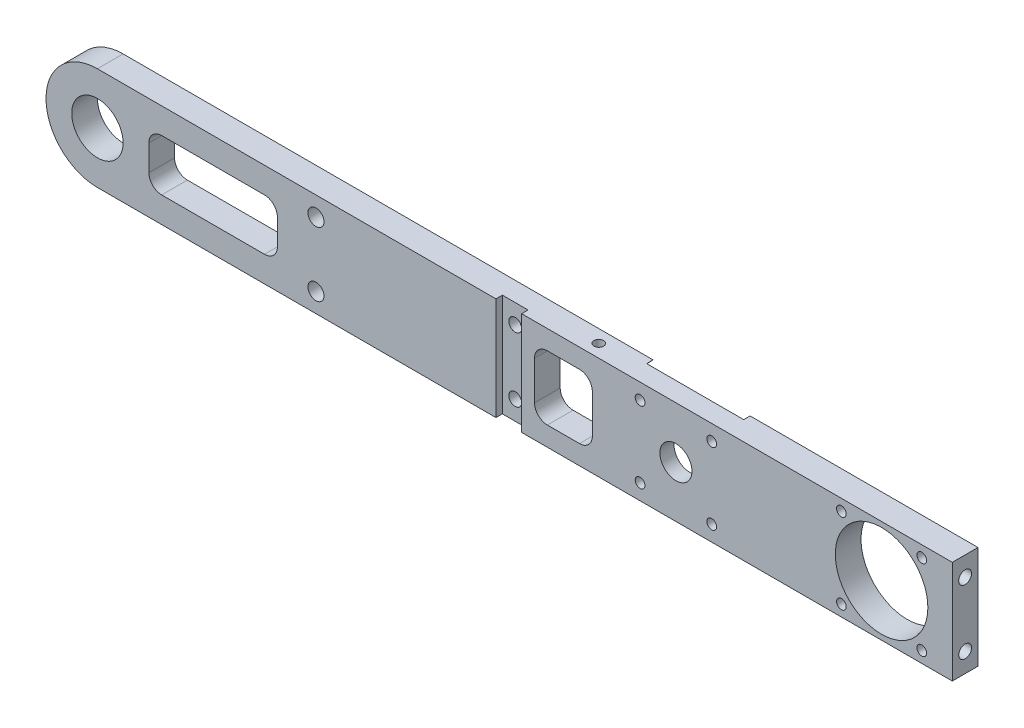
from build123d import *
from build123d.topology import SkipClean

# Parameters (mm, degrees)
SKETCH1_R           = 12.7
SKETCH1_R_2         = 7.9375
SKETCH1_R_3         = 22.86
EXTRUDE1_DEPTH      = 12.7
SKETCH2_W           = 12.7
SKETCH2_H           = 50.8
CUT_EXTRUDE1_DEPTH  = 3.175
SKETCH4_R           = 34.925
CUT_EXTRUDE3_DEPTH  = 3.175
SKETCH5_R           = 17.4625
CUT_EXTRUDE4_DEPTH  = 2.54
CUT_EXTRUDE5_DEPTH  = 451.727007872
SKETCH7_R           = 12.7
CUT_EXTRUDE6_DEPTH  = 9.525
SKETCH8_R           = 2.413
CUT_EXTRUDE7_DEPTH  = 451.648722677
CIRPATTERN1_COUNT   = 4
SKETCH9_R           = 2.38125
CUT_EXTRUDE8_DEPTH  = 451.727007872
SKETCH10_R          = 3.96875
CUT_EXTRUDE9_DEPTH  = 451.727007872
SKETCH11_W          = 41.275
SKETCH11_H          = 31.75
EXTRUDE2_DEPTH      = 3.175
CUT_EXTRUDE10_REACH = 452.727
SKETCH12_R          = 3.175
SKETCH13_R          = 3.175
CUT_EXTRUDE11_DEPTH = 451.648722679
SKETCH15_R          = 2.38125
CUT_EXTRUDE13_DEPTH = 15.875
CUT_EXTRUDE14_START = -15.875
SKETCH16_R          = 2.38125
CUT_EXTRUDE14_DEPTH = 15.875


with BuildPart() as part:
    # Sketch1 → Extrude1 (new body)
    with BuildSketch(Plane.XY):
        with BuildLine():
            Line((0, 50.8), (-422.275, 50.8))
            ThreePointArc((-422.275, 50.8), (-447.675, 25.4), (-422.275, 0))
            Line((-422.275, 0), (0, 0))
            Line((0, 0), (0, 50.8))
        make_face()
        with Locations((-422.275, 25.4)):
            Circle(SKETCH1_R, mode=Mode.SUBTRACT)
        with Locations((-136.525, 25.4)):
            Circle(SKETCH1_R_2, mode=Mode.SUBTRACT)
        with Locations((-34.925, 25.4)):
            Circle(SKETCH1_R_3, mode=Mode.SUBTRACT)
    extrude(amount=EXTRUDE1_DEPTH)

    # Sketch2 → Cut-Extrude1 (cut)
    with BuildSketch(Plane.XY.offset(12.7)):
        with Locations((-219.075, 25.4)):
            Rectangle(SKETCH2_W, SKETCH2_H)
    extrude(amount=-CUT_EXTRUDE1_DEPTH, mode=Mode.SUBTRACT)

    # Sketch4 → Cut-Extrude3 (cut)
    with BuildSketch(Plane(origin=(0, 0, 0), x_dir=(-1, 0, 0), z_dir=(0, 0, -1))):
        with Locations((136.525, 25.4)):
            Circle(SKETCH4_R)
    extrude(amount=-CUT_EXTRUDE3_DEPTH, mode=Mode.SUBTRACT)

    # Sketch5 → Cut-Extrude4 (cut)
    with BuildSketch(Plane(origin=(0, 0, 3.175), x_dir=(-1, 0, 0), z_dir=(0, 0, -1))):
        with Locations((136.525, 25.4)):
            Circle(SKETCH5_R)
    extrude(amount=-CUT_EXTRUDE4_DEPTH, mode=Mode.SUBTRACT)

    # Sketch6 → Cut-Extrude5 (cut, through all)
    with BuildSketch(Plane.XY.offset(12.7)):
        with BuildLine():
            Line((-390.525, 38.1), (-339.725, 38.1))
            ThreePointArc((-339.725, 38.1), (-335.234871939, 36.240128061), (-333.375, 31.75))
            Line((-333.375, 31.75), (-333.375, 19.05))
            ThreePointArc((-333.375, 19.05), (-335.234871939, 14.559871939), (-339.725, 12.7))
            Line((-339.725, 12.7), (-390.525, 12.7))
            ThreePointArc((-390.525, 12.7), (-395.015128061, 14.559871939), (-396.875, 19.05))
            Line((-396.875, 19.05), (-396.875, 31.75))
            ThreePointArc((-396.875, 31.75), (-395.015128061, 36.240128061), (-390.525, 38.1))
        make_face()
        with BuildLine():
            Line((-266.7, 41.275), (-238.125, 41.275))
            ThreePointArc((-238.125, 41.275), (-233.634871939, 39.415128061), (-231.775, 34.925))
            Line((-231.775, 34.925), (-231.775, 15.875))
            ThreePointArc((-231.775, 15.875), (-233.634871939, 11.384871939), (-238.125, 9.525))
            Line((-238.125, 9.525), (-266.7, 9.525))
            ThreePointArc((-266.7, 9.525), (-271.190128061, 11.384871939), (-273.05, 15.875))
            Line((-273.05, 15.875), (-273.05, 34.925))
            ThreePointArc((-273.05, 34.925), (-271.190128061, 39.415128061), (-266.7, 41.275))
        make_face()
        with BuildLine():
            Line((-200.025, 41.275), (-184.15, 41.275))
            ThreePointArc((-184.15, 41.275), (-179.659871939, 39.415128061), (-177.8, 34.925))
            Line((-177.8, 34.925), (-177.8, 15.875))
            ThreePointArc((-177.8, 15.875), (-179.659871939, 11.384871939), (-184.15, 9.525))
            Line((-184.15, 9.525), (-200.025, 9.525))
            ThreePointArc((-200.025, 9.525), (-204.515128061, 11.384871939), (-206.375, 15.875))
            Line((-206.375, 15.875), (-206.375, 34.925))
            ThreePointArc((-206.375, 34.925), (-204.515128061, 39.415128061), (-200.025, 41.275))
        make_face()
    extrude(amount=-CUT_EXTRUDE5_DEPTH, mode=Mode.SUBTRACT)

    # Sketch7 → Cut-Extrude6 (cut)
    with BuildSketch(Plane(origin=(0, 0, 0), x_dir=(-1, 0, 0), z_dir=(0, 0, -1))):
        with Locations((80.9625, 31.75)):
            Circle(SKETCH7_R)
    extrude(amount=-CUT_EXTRUDE6_DEPTH, mode=Mode.SUBTRACT)

    # Sketch8 → Cut-Extrude7 (cut, through all)
    with BuildSketch(Plane(origin=(0, 0, 3.175), x_dir=(-1, 0, 0), z_dir=(0, 0, -1))):
        with Locations((118.833895441, 43.091104559)):
            Circle(SKETCH8_R)
    cut_extrude7 = extrude(amount=-CUT_EXTRUDE7_DEPTH, mode=Mode.SUBTRACT)

    # CirPattern1: Cut-Extrude7 ×4 about axis
    cirpattern1_axis = Axis((-136.525, 25.4, 0), (0, 0, 1))
    for i in range(1, CIRPATTERN1_COUNT):
        add(cut_extrude7.rotate(cirpattern1_axis, i * 360 / CIRPATTERN1_COUNT), mode=Mode.SUBTRACT)

    # Sketch9 → Cut-Extrude8 (cut, through all)
    with BuildSketch(Plane(origin=(0, 0, 0), x_dir=(-1, 0, 0), z_dir=(0, 0, -1))):
        with Locations((15.08125, 45.24375)):
            Circle(SKETCH9_R)
        with Locations((54.76875, 45.24375)):
            Circle(SKETCH9_R)
        with Locations((54.76875, 5.55625)):
            Circle(SKETCH9_R)
        with Locations((15.08125, 5.55625)):
            Circle(SKETCH9_R)
    extrude(amount=-CUT_EXTRUDE8_DEPTH, mode=Mode.SUBTRACT)

    # Sketch10 → Cut-Extrude9 (cut, through all)
    with BuildSketch(Plane(origin=(0, 0, 0), x_dir=(-1, 0, 0), z_dir=(0, 0, -1))):
        with Locations((314.325, 41.275)):
            Circle(SKETCH10_R)
        with Locations((314.325, 9.525)):
            Circle(SKETCH10_R)
    extrude(amount=-CUT_EXTRUDE9_DEPTH, mode=Mode.SUBTRACT)

    # Sketch11 → Extrude2 (add)
    with BuildSketch(Plane.XY.offset(12.7)):
        with Locations((-252.4125, 25.4)):
            Rectangle(SKETCH11_W, SKETCH11_H)
    extrude(amount=-EXTRUDE2_DEPTH)

    # Sketch12 → Cut-Extrude10 (cut, up to next)
    with BuildSketch(Plane(origin=(0, 0, 0), x_dir=(0, 0, -1), z_dir=(1, 0, 0)), mode=Mode.PRIVATE) as cut_extrude10_sk1:
        with Locations(Location((-6.35, 9.525, 0), (0, 0, 90))):
            Circle(SKETCH12_R)
    cut_extrude10_tool1 = extrude(cut_extrude10_sk1.sketch, amount=-CUT_EXTRUDE10_REACH, mode=Mode.PRIVATE) & part.part
    # Sketch12 → Cut-Extrude10 (cut, up to next)
    with BuildSketch(Plane(origin=(0, 0, 0), x_dir=(0, 0, -1), z_dir=(1, 0, 0)), mode=Mode.PRIVATE) as cut_extrude10_sk2:
        with Locations(Location((-6.35, 41.275, 0), (0, 0, 90))):
            Circle(SKETCH12_R)
    cut_extrude10_tool2 = extrude(cut_extrude10_sk2.sketch, amount=-CUT_EXTRUDE10_REACH, mode=Mode.PRIVATE) & part.part
    add(cut_extrude10_tool1.solids().sort_by_distance((0, 9.525, 6.35))[0], mode=Mode.SUBTRACT)
    add(cut_extrude10_tool2.solids().sort_by_distance((0, 41.275, 6.35))[0], mode=Mode.SUBTRACT)

    # Sketch13 → Cut-Extrude11 (cut, through all)
    with BuildSketch(Plane.XY.offset(9.525)):
        with Locations((-219.075, 41.275)):
            Circle(SKETCH13_R)
        with Locations((-219.075, 9.525)):
            Circle(SKETCH13_R)
    extrude(amount=-CUT_EXTRUDE11_DEPTH, mode=Mode.SUBTRACT)

    # Cut-Extrude12 cone 1 section (through the dimple's axis) → Cut-Extrude12 (revolve, cut)
    with BuildSketch(Plane(origin=(-219.075, 41.275, 0), x_dir=(0, 1, 0), z_dir=(1, 0, 0))):
        Polygon((0, 0), (6.7437, 0), (0, 7.757739428), align=None)
    revolve(axis=Axis((-219.075, 41.275, 0), (0, 0, 1)), mode=Mode.SUBTRACT)

    # Cut-Extrude12 cone 2 section (through the dimple's axis) → Cut-Extrude12 cone 2 (revolve, cut)
    with BuildSketch(Plane(origin=(-219.075, 9.525, 0), x_dir=(0, 1, 0), z_dir=(1, 0, 0))):
        Polygon((0, 0), (6.7437, 0), (0, 7.757739428), align=None)
    revolve(axis=Axis((-219.075, 9.525, 0), (0, 0, 1)), mode=Mode.SUBTRACT)

    # Sketch15 → Cut-Extrude13 (cut)
    with BuildSketch(Plane(origin=(0, 50.8, 0), x_dir=(-1, 0, 0), z_dir=(0, 1, 0))):
        with Locations((180.975, 6.35)):
            Circle(SKETCH15_R)
    extrude(amount=-CUT_EXTRUDE13_DEPTH, mode=Mode.SUBTRACT)

    # Sketch16 → Cut-Extrude14 (cut)
    with BuildSketch(Plane.XZ.offset(CUT_EXTRUDE14_START)):
        with Locations(Location((-180.975, 6.35, 0), (0, 0, 180))):
            Circle(SKETCH16_R)
    extrude(amount=CUT_EXTRUDE14_DEPTH, mode=Mode.SUBTRACT)


solid = part.part
